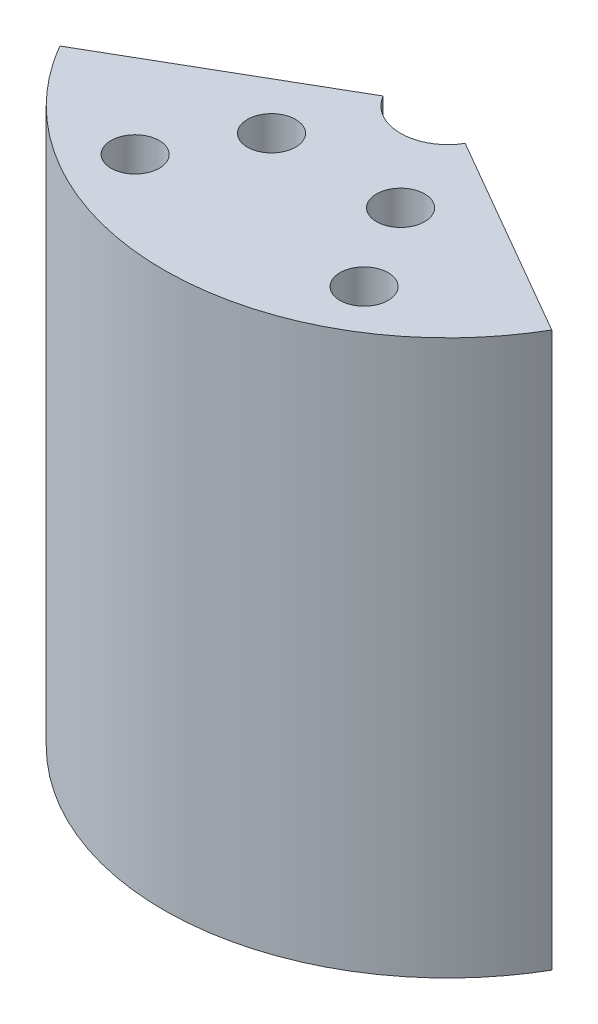
from build123d import *

# Parameters (mm, degrees)
F_3DSKETCH3_R   = 7000.000150263
F_3DSKETCH3_R_2 = 6999.999284238
EXTRUDE2_DEPTH  = 161065.432


with BuildPart() as part:
    # 3DSketch3 → Extrude2 (new body)
    with BuildSketch(Plane(origin=(-71447.096, -157953.272, 41250), x_dir=(1, 0, 0), z_dir=(0, -1, 0))):
        with BuildLine():
            Line((0, 0), (59539.247, -34375))
            add(Edge.make_bspline(
                [(83354.945, -34375), (83254.8989917, -34206.550823565), (83054.807042075, -33869.652583461), (82727.639268767, -33381.150363429), (82381.425352971, -32906.121222224), (82014.81992767, -32446.574904402), (81629.022493785, -32003.045022411), (81224.59773215, -31576.422611552), (80802.319190872, -31167.467154384), (80362.950330838, -30776.929684835), (79907.295947271, -30405.522485184), (79436.187165688, -30053.925381594), (78950.485066754, -29722.779768258), (78451.077403004, -29412.688789506), (77938.874492313, -29124.222574052), (77414.81390024, -28857.905587985), (76879.852899393, -28614.223563373), (76334.966988152, -28393.625508921), (75781.153545009, -28196.50854725), (75219.422698436, -28023.238254496), (74650.801039393, -27874.128832613), (74076.327487331, -27749.452022579), (73497.051330368, -27649.435128763), (72914.030489352, -27574.263661225), (72328.330037419, -27524.072163585), (71741.019728517, -27498.953572469), (71153.172271483, -27498.953572469), (70565.861962581, -27524.072163585), (69980.161510648, -27574.263661225), (69397.140669632, -27649.435128763), (68817.864512669, -27749.452022579), (68243.390960607, -27874.128832613), (67674.769301564, -28023.238254496), (67113.038454991, -28196.50854725), (66559.225011848, -28393.625508921), (66014.339100607, -28614.223563373), (65479.37809976, -28857.905587985), (64955.317507687, -29124.222574052), (64443.114596996, -29412.688789506), (63943.706933246, -29722.779768258), (63458.004834312, -30053.925381594), (62986.896052729, -30405.522485184), (62531.241669163, -30776.929684835), (62091.872809128, -31167.467154384), (61669.59426785, -31576.422611552), (61265.169506215, -32003.045022411), (60879.37207233, -32446.574904402), (60512.766647029, -32906.121222224), (60166.552731233, -33381.150363429), (59839.384957925, -33869.652583461), (59639.2930083, -34206.550823565), (59539.247, -34375)],
                knots=[0, 0, 0, 0, 0.020408161, 0.040816309, 0.061224467, 0.081632664, 0.102040816, 0.122448986, 0.142857137, 0.163265315, 0.183673484, 0.204081629, 0.22448978, 0.24489795, 0.265306134, 0.285714297, 0.306122442, 0.326530617, 0.346938779, 0.36734695, 0.387755093, 0.408163267, 0.428571434, 0.448979581, 0.469387738, 0.489795921, 0.510204079, 0.530612262, 0.551020419, 0.571428566, 0.591836733, 0.612244907, 0.63265305, 0.653061221, 0.673469383, 0.693877558, 0.714285703, 0.734693866, 0.75510205, 0.77551022, 0.795918371, 0.816326516, 0.836734685, 0.857142863, 0.877551014, 0.897959184, 0.918367336, 0.938775533, 0.959183691, 0.979591839, 1, 1, 1, 1], degree=3))
            Line((83354.945, -34375), (142894.192, 0))
            add(Edge.make_bspline(
                [(142894.192, 0), (142293.916924852, 1010.695813468), (141093.366809055, 3032.087382318), (139130.350862086, 5963.096300934), (137053.070850452, 8813.272698756), (134853.440878433, 11570.551416727), (132538.659742276, 14231.731489293), (130112.105261846, 16791.461611393), (127578.437696539, 19245.19757436), (124942.225066217, 21588.422908126), (122208.296100084, 23816.862756002), (119381.644091761, 25926.448840338), (116467.431679275, 27913.325209541), (113470.98142843, 29773.862864992), (110397.768348819, 31504.664655511), (107253.405368344, 33102.56842666), (104043.635787814, 34564.652864499), (100774.324276087, 35888.251759134), (97451.440926608, 37070.942929143), (94081.056695991, 38110.570302926), (90669.327359854, 39005.230126746), (87222.485500045, 39753.290798711), (83746.827513855, 40353.386889113), (80248.701794922, 40804.419751654), (76734.498878298, 41105.567940775), (73210.637353857, 41256.27842661), (69683.554646143, 41256.27842661), (66159.693121702, 41105.567940775), (62645.490205078, 40804.419751654), (59147.364486145, 40353.386889113), (55671.706499955, 39753.290798711), (52224.864640146, 39005.230126746), (48813.135304009, 38110.570302926), (45442.751073392, 37070.942929143), (42119.867723913, 35888.251759134), (38850.556212186, 34564.652864499), (35640.786631656, 33102.56842666), (32496.423651181, 31504.664655511), (29423.21057157, 29773.862864992), (26426.760320725, 27913.325209541), (23512.547908239, 25926.448840338), (20685.895899916, 23816.862756002), (17951.966933783, 21588.422908126), (15315.754303461, 19245.19757436), (12782.086738154, 16791.461611393), (10355.532257724, 14231.731489293), (8040.751121567, 11570.551416727), (5841.121149548, 8813.272698756), (3763.841137914, 5963.096300934), (1800.825190945, 3032.087382318), (600.275075148, 1010.695813468), (0, 0)],
                knots=[0, 0, 0, 0, 0.020408163, 0.040816325, 0.061224492, 0.081632653, 0.102040814, 0.122448979, 0.142857141, 0.163265306, 0.183673472, 0.204081632, 0.224489799, 0.244897958, 0.265306124, 0.28571429, 0.306122451, 0.32653061, 0.346938775, 0.367346938, 0.387755104, 0.408163264, 0.428571428, 0.448979594, 0.469387756, 0.489795916, 0.510204084, 0.530612244, 0.551020406, 0.571428572, 0.591836736, 0.612244896, 0.632653062, 0.653061225, 0.67346939, 0.693877549, 0.71428571, 0.734693876, 0.755102042, 0.775510201, 0.795918368, 0.816326528, 0.836734694, 0.857142859, 0.877551021, 0.897959186, 0.918367347, 0.938775508, 0.959183675, 0.979591837, 1, 1, 1, 1], degree=3))
        make_face()
        with Locations(Location((104697.096, 16340.689, 0), (0, 0, 90))):
            Circle(F_3DSKETCH3_R, mode=Mode.SUBTRACT)
        with Locations(Location((90197.096, -8774.047, 0), (0, 0, 90))):
            Circle(F_3DSKETCH3_R_2, mode=Mode.SUBTRACT)
        with Locations(Location((52697.096, -8774.047, 0), (0, 0, 90))):
            Circle(F_3DSKETCH3_R_2, mode=Mode.SUBTRACT)
        with Locations(Location((38197.096, 16340.689, 0), (0, 0, 90))):
            Circle(F_3DSKETCH3_R, mode=Mode.SUBTRACT)
    extrude(amount=-EXTRUDE2_DEPTH)


solid = part.part
